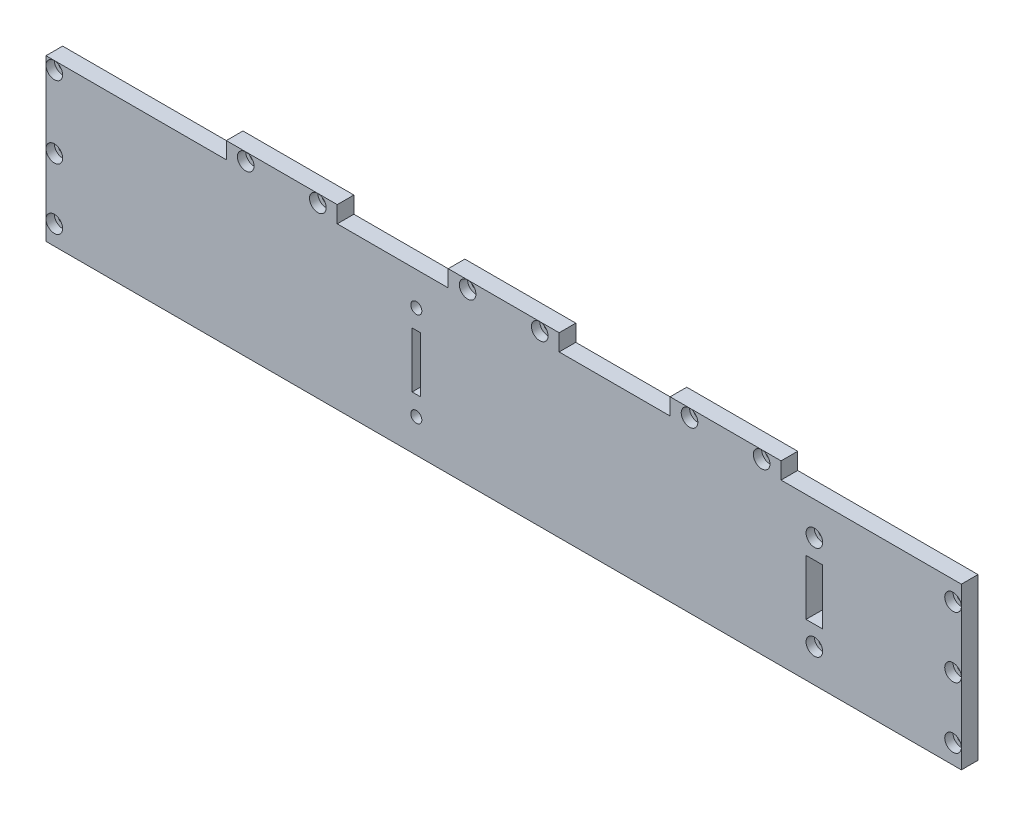
from build123d import *

# Parameters (mm, degrees)
ESQUISSE1_W             = 330
ESQUISSE1_H             = 64
BOSS_EXTRU_1_DEPTH      = 6
ESQUISSE2_W             = 65
ESQUISSE2_H             = 6
ESQUISSE2_W_2           = 40
ENL_V_MAT_EXTRU_1_DEPTH = 337.20232004
ESQUISSE3_W             = 3
ESQUISSE3_H             = 20
ESQUISSE3_W_2           = 6
ENL_V_MAT_EXTRU_2_DEPTH = 337.20232004
ESQUISSE4_R             = 1.5
ESQUISSE4_R_2           = 1.005
ENL_V_MAT_EXTRU_3_DEPTH = 337.20232004
ESQUISSE5_R             = 2.995
ESQUISSE5_R_2           = 2
ENL_V_MAT_EXTRU_4_DEPTH = 3


with BuildPart() as part:
    # Esquisse1 → Boss.-Extru.1 (new body)
    with BuildSketch(Plane.XY):
        with Locations((-165, 32)):
            Rectangle(ESQUISSE1_W, ESQUISSE1_H)
    extrude(amount=BOSS_EXTRU_1_DEPTH)

    # Esquisse2 → Enlèv. mat.-Extru.1 (cut, through all)
    with BuildSketch(Plane.XY.offset(6)):
        with Locations((-297.5, 61)):
            Rectangle(ESQUISSE2_W, ESQUISSE2_H)
        with Locations((-205, 61)):
            Rectangle(ESQUISSE2_W_2, ESQUISSE2_H)
        with Locations((-125, 61)):
            Rectangle(ESQUISSE2_W_2, ESQUISSE2_H)
        with Locations((-32.5, 61)):
            Rectangle(ESQUISSE2_W, ESQUISSE2_H)
    extrude(amount=-ENL_V_MAT_EXTRU_1_DEPTH, mode=Mode.SUBTRACT)

    # Esquisse3 → Enlèv. mat.-Extru.2 (cut, through all)
    with BuildSketch(Plane.XY.offset(6)):
        with Locations((-196.5, 29)):
            Rectangle(ESQUISSE3_W, ESQUISSE3_H)
        with Locations((-53, 29)):
            Rectangle(ESQUISSE3_W_2, ESQUISSE3_H)
    extrude(amount=-ENL_V_MAT_EXTRU_2_DEPTH, mode=Mode.SUBTRACT)

    # Esquisse4 → Enlèv. mat.-Extru.3 (cut, through all)
    with BuildSketch(Plane.XY.offset(6)):
        with Locations((-327, 55)):
            Circle(ESQUISSE4_R)
        with Locations((-327, 29)):
            Circle(ESQUISSE4_R)
        with Locations((-327, 7)):
            Circle(ESQUISSE4_R)
        with Locations((-258, 61)):
            Circle(ESQUISSE4_R)
        with Locations((-232, 61)):
            Circle(ESQUISSE4_R)
        with Locations((-178, 61)):
            Circle(ESQUISSE4_R)
        with Locations((-152, 61)):
            Circle(ESQUISSE4_R)
        with Locations((-98, 61)):
            Circle(ESQUISSE4_R)
        with Locations((-72, 61)):
            Circle(ESQUISSE4_R)
        with Locations((-53, 46)):
            Circle(ESQUISSE4_R)
        with Locations((-53, 12)):
            Circle(ESQUISSE4_R)
        with Locations((-196.5, 46)):
            Circle(ESQUISSE4_R_2)
        with Locations((-196.5, 12)):
            Circle(ESQUISSE4_R_2)
        with Locations((-3, 51)):
            Circle(ESQUISSE4_R)
        with Locations((-3, 29)):
            Circle(ESQUISSE4_R)
        with Locations((-3, 7)):
            Circle(ESQUISSE4_R)
    extrude(amount=-ENL_V_MAT_EXTRU_3_DEPTH, mode=Mode.SUBTRACT)

    # Esquisse5 → Enlèv. mat.-Extru.4 (cut)
    with BuildSketch(Plane.XY.offset(6)):
        with Locations((-327, 7)):
            Circle(ESQUISSE5_R)
        with Locations((-327, 29)):
            Circle(ESQUISSE5_R)
        with Locations((-327, 55)):
            Circle(ESQUISSE5_R)
        with Locations((-258, 61)):
            Circle(ESQUISSE5_R)
        with Locations((-232, 61)):
            Circle(ESQUISSE5_R)
        with Locations((-196.5, 46)):
            Circle(ESQUISSE5_R_2)
        with Locations((-178, 61)):
            Circle(ESQUISSE5_R)
        with Locations((-152, 61)):
            Circle(ESQUISSE5_R)
        with Locations((-98, 61)):
            Circle(ESQUISSE5_R)
        with Locations((-72, 61)):
            Circle(ESQUISSE5_R)
        with Locations((-53, 46)):
            Circle(ESQUISSE5_R)
        with Locations((-53, 12)):
            Circle(ESQUISSE5_R)
        with Locations((-3, 7)):
            Circle(ESQUISSE5_R)
        with Locations((-3, 29)):
            Circle(ESQUISSE5_R)
        with Locations((-3, 51)):
            Circle(ESQUISSE5_R)
        with Locations((-196.5, 12)):
            Circle(ESQUISSE5_R_2)
    extrude(amount=-ENL_V_MAT_EXTRU_4_DEPTH, mode=Mode.SUBTRACT)


solid = part.part
